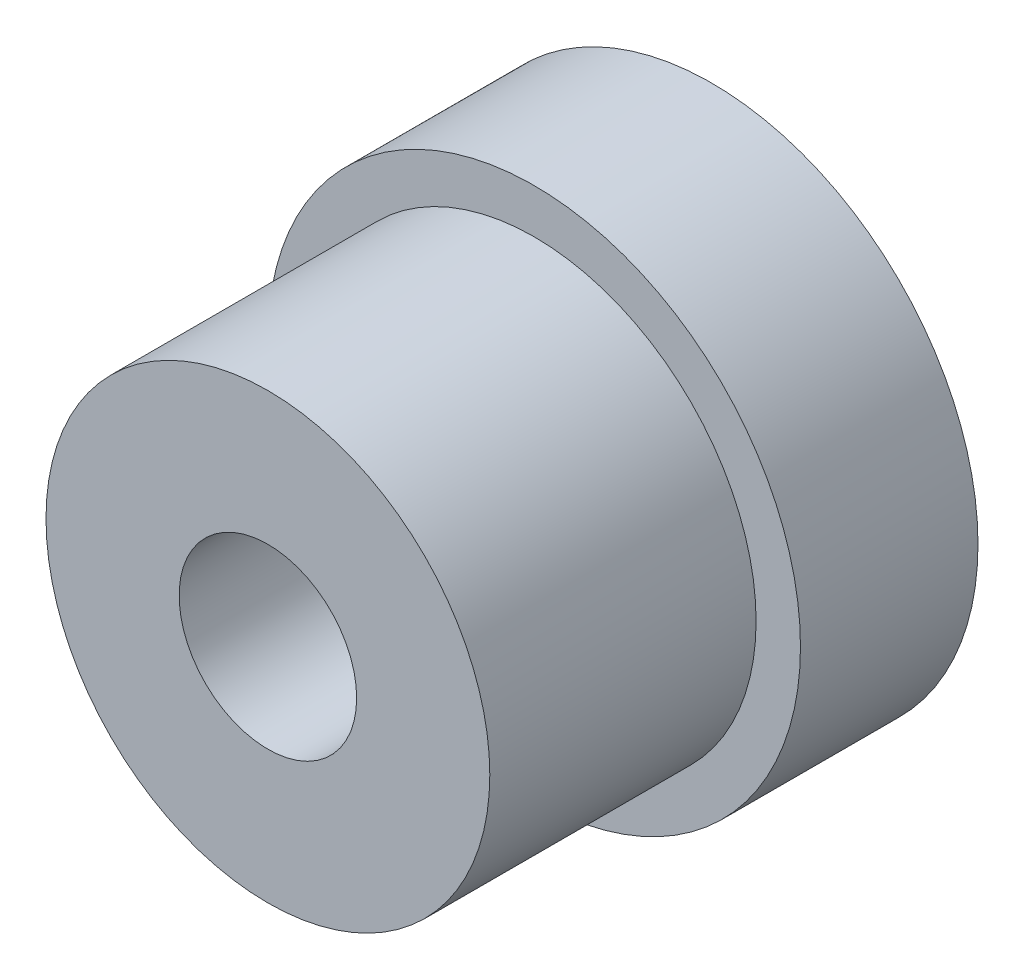
from build123d import *

# Parameters (mm, degrees)
SKETCH1_R           = 4.7625
BOSS_EXTRUDE1_DEPTH = 3.175
SKETCH2_R           = 3.96875
BOSS_EXTRUDE2_DEPTH = 4.7625
SKETCH3_R           = 1.5875
CUT_EXTRUDE1_DEPTH  = 11.409933657


with BuildPart() as part:
    # Sketch1 → Boss-Extrude1 (new body)
    with BuildSketch(Plane.XY):
        Circle(SKETCH1_R)
    extrude(amount=BOSS_EXTRUDE1_DEPTH)

    # Sketch2 → Boss-Extrude2 (add)
    with BuildSketch(Plane.XY.offset(3.175)):
        with Locations(Location((0, 0, 0), (0, 0, 180))):
            Circle(SKETCH2_R)
    extrude(amount=BOSS_EXTRUDE2_DEPTH)

    # Sketch3 → Cut-Extrude1 (cut, through all)
    with BuildSketch(Plane.XY.offset(7.9375)):
        Circle(SKETCH3_R)
    extrude(amount=-CUT_EXTRUDE1_DEPTH, mode=Mode.SUBTRACT)


solid = part.part
